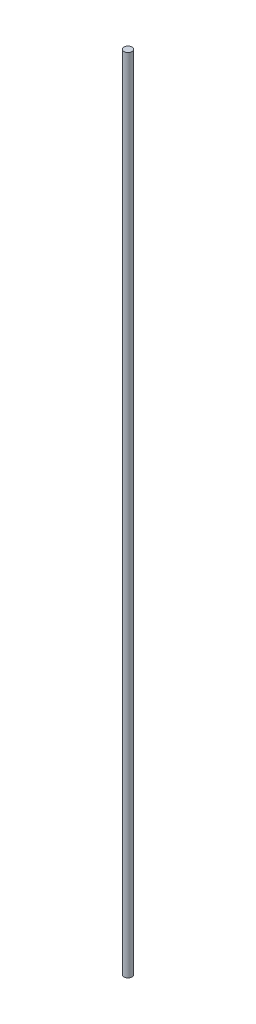
from build123d import *

# Parameters (mm, degrees)
SKETCH1_R           = 2
BOSS_EXTRUDE2_DEPTH = 400


with BuildPart() as part:
    # Sketch1 → Boss-Extrude2 (new body)
    with BuildSketch(Plane(origin=(0, 0, 0), x_dir=(1, 0, 0), z_dir=(0, 1, 0))):
        with Locations(Location((0, 0, 0), (0, 0, 270))):
            Circle(SKETCH1_R)
    extrude(amount=BOSS_EXTRUDE2_DEPTH)


solid = part.part
